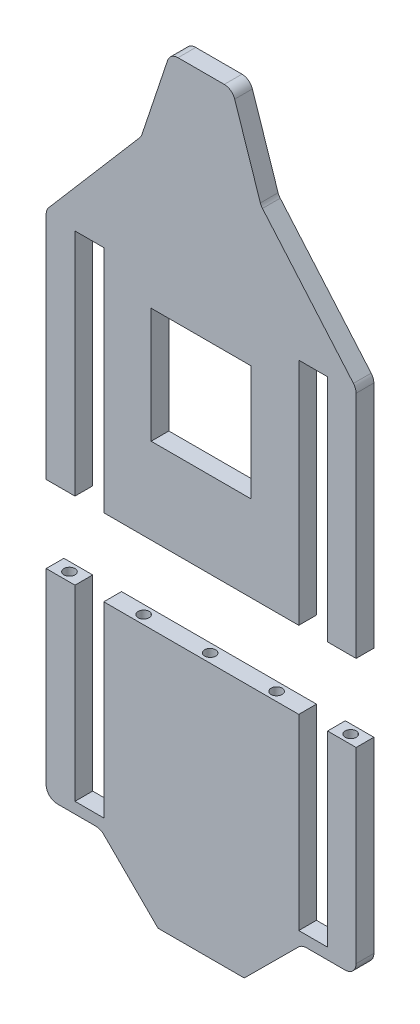
from build123d import *

# Parameters (mm, degrees)
SKETCH1_W              = 13
SKETCH1_H              = 188.148975749
BOSS_EXTRUDE1_DEPTH    = 8
SKETCH2_W              = 45
SKETCH2_H              = 52
CUT_EXTRUDE1_DEPTH     = 341.17998495
SPLIT1_SURFACE_1_BACK  = 341.18
SPLIT1_SURFACE_1_DEPTH = 682.36
SPLIT1_SURFACE_2_BACK  = 341.18
SPLIT1_SURFACE_2_DEPTH = 682.36
SKETCH5_R              = 2.5
CUT_EXTRUDE6_DEPTH     = 5.2
CUT_EXTRUDE7_START     = -5.2
SKETCH4_R              = 2.5
CUT_EXTRUDE7_DEPTH     = 5.2


with BuildPart() as part:
    # Sketch1 → Boss-Extrude1 (new body)
    with BuildSketch(Plane.XY):
        with BuildLine():
            Line((0, 30.859943174), (0, 219.008918923))
            ThreePointArc((0, 219.008918923), (0.311003468, 220.744808182), (1.205324608, 222.264750409))
            Line((1.205324608, 222.264750409), (42.261389271, 270.115641625))
            ThreePointArc((42.261389271, 270.115641625), (42.81710491, 270.906904614), (43.210130369, 271.790334282))
            Line((43.210130369, 271.790334282), (54.802396658, 306.567133147))
            ThreePointArc((54.802396658, 306.567133147), (56.605292439, 309.029920375), (59.503914938, 309.985818768))
            Line((59.503914938, 309.985818768), (80.378944352, 309.985818768))
            ThreePointArc((80.378944352, 309.985818768), (83.277566851, 309.029920375), (85.080462632, 306.567133147))
            Line((85.080462632, 306.567133147), (96.672728921, 271.790334282))
            ThreePointArc((96.672728921, 271.790334282), (97.06575438, 270.906904614), (97.621470019, 270.115641625))
            Line((97.621470019, 270.115641625), (138.677534682, 222.264750409))
            ThreePointArc((138.677534682, 222.264750409), (139.571855822, 220.744808182), (139.88285929, 219.008918923))
            Line((139.88285929, 219.008918923), (139.88285929, 30.859943174))
            ThreePointArc((139.88285929, 30.859943174), (138.418393196, 27.324409268), (134.88285929, 25.859943174))
            Line((134.88285929, 25.859943174), (117.446021446, 25.859943174))
            ThreePointArc((117.446021446, 25.859943174), (115.538843756, 25.481920377), (113.920048724, 24.405012478))
            Line((113.920048724, 24.405012478), (89.38285929, 0))
            Line((89.38285929, 0), (50.5, 0))
            Line((50.5, 0), (25.962810565, 24.405012478))
            ThreePointArc((25.962810565, 24.405012478), (24.344015534, 25.481920377), (22.436837844, 25.859943174))
            Line((22.436837844, 25.859943174), (5, 25.859943174))
            ThreePointArc((5, 25.859943174), (1.464466094, 27.324409268), (0, 30.859943174))
        make_face()
        with Locations((19.5, 124.934431049)):
            Rectangle(SKETCH1_W, SKETCH1_H, mode=Mode.SUBTRACT)
        with Locations((120.5, 124.934431049)):
            Rectangle(SKETCH1_W, SKETCH1_H, mode=Mode.SUBTRACT)
    extrude(amount=BOSS_EXTRUDE1_DEPTH)

    # Sketch2 → Cut-Extrude1 (cut, through all)
    with BuildSketch(Plane.XY.offset(8)):
        with Locations((69.88285929, 180.008918923)):
            Rectangle(SKETCH2_W, SKETCH2_H)
    extrude(amount=-CUT_EXTRUDE1_DEPTH, mode=Mode.SUBTRACT)


with BuildPart() as body_2:
    # Split1: the piece behind the surface
    add(part.part)
    # Split1 surface: a surface, the sketch's curves swept straight by 682.36 mm
    with BuildLine(Plane(origin=(0, 0, 0), x_dir=(-1, 0, 0), z_dir=(0, 0, -1)).offset(-SPLIT1_SURFACE_1_BACK), mode=Mode.PRIVATE) as split1_surface_1_path:
        Line((0, 115.359943174), (-139.88285929, 115.359943174))
    split1_surface_1 = Shell.extrude(split1_surface_1_path.wire(), (0 * SPLIT1_SURFACE_1_DEPTH, 0 * SPLIT1_SURFACE_1_DEPTH, -1 * SPLIT1_SURFACE_1_DEPTH))
    split(bisect_by=split1_surface_1, keep=Keep.BOTTOM)


with BuildPart() as part_1:
    add(part.part)

    # Split1: split by a surface, the side it looks to stays
    # Split1 surface: a surface, the sketch's curves swept straight by 682.36 mm
    with BuildLine(Plane(origin=(0, 0, 0), x_dir=(-1, 0, 0), z_dir=(0, 0, -1)).offset(-SPLIT1_SURFACE_2_BACK), mode=Mode.PRIVATE) as split1_surface_2_path:
        Line((0, 115.359943174), (-139.88285929, 115.359943174))
    split1_surface_2 = Shell.extrude(split1_surface_2_path.wire(), (0 * SPLIT1_SURFACE_2_DEPTH, 0 * SPLIT1_SURFACE_2_DEPTH, -1 * SPLIT1_SURFACE_2_DEPTH))
    split(bisect_by=split1_surface_2, keep=Keep.TOP)

    # Sketch5 → Cut-Extrude6 (cut)
    with BuildSketch(Plane(origin=(0, 115.359943174, -115.359943174), x_dir=(1, 0, 0), z_dir=(0, -1, 0))):
        with Locations(Location((133.441429645, 119.359943174, 0), (0, 0, 270))):
            Circle(SKETCH5_R)
        with Locations(Location((70, 119.359943174, 0), (0, 0, 270))):
            Circle(SKETCH5_R)
        with Locations(Location((100, 119.359943174, 0), (0, 0, 270))):
            Circle(SKETCH5_R)
        with Locations(Location((40, 119.359943174, 0), (0, 0, 270))):
            Circle(SKETCH5_R)
        with Locations(Location((6.5, 119.359943174, 0), (0, 0, 270))):
            Circle(SKETCH5_R)
    extrude(amount=CUT_EXTRUDE6_DEPTH, mode=Mode.SUBTRACT)


with BuildPart() as body_2_1:
    # Body-Move/Copy1: moved
    add(body_2.part.moved(Location((0, 34.793425009, 0))))

    # Sketch4 → Cut-Extrude7 (cut)
    with BuildSketch(Plane(origin=(0, 150.153368183, 0), x_dir=(-1, 0, 0), z_dir=(0, -1, 0)).offset(CUT_EXTRUDE7_START)):
        with Locations(Location((-6.5, -4, 0), (0, 0, 90))):
            Circle(SKETCH4_R)
        with Locations(Location((-70, -4, 0), (0, 0, 90))):
            Circle(SKETCH4_R)
        with Locations(Location((-40, -4, 0), (0, 0, 90))):
            Circle(SKETCH4_R)
        with Locations(Location((-100, -4, 0), (0, 0, 90))):
            Circle(SKETCH4_R)
        with Locations(Location((-133.441429645, -4, 0), (0, 0, 90))):
            Circle(SKETCH4_R)
    extrude(amount=CUT_EXTRUDE7_DEPTH, mode=Mode.SUBTRACT)


solid = Compound([part_1.part, body_2_1.part])
